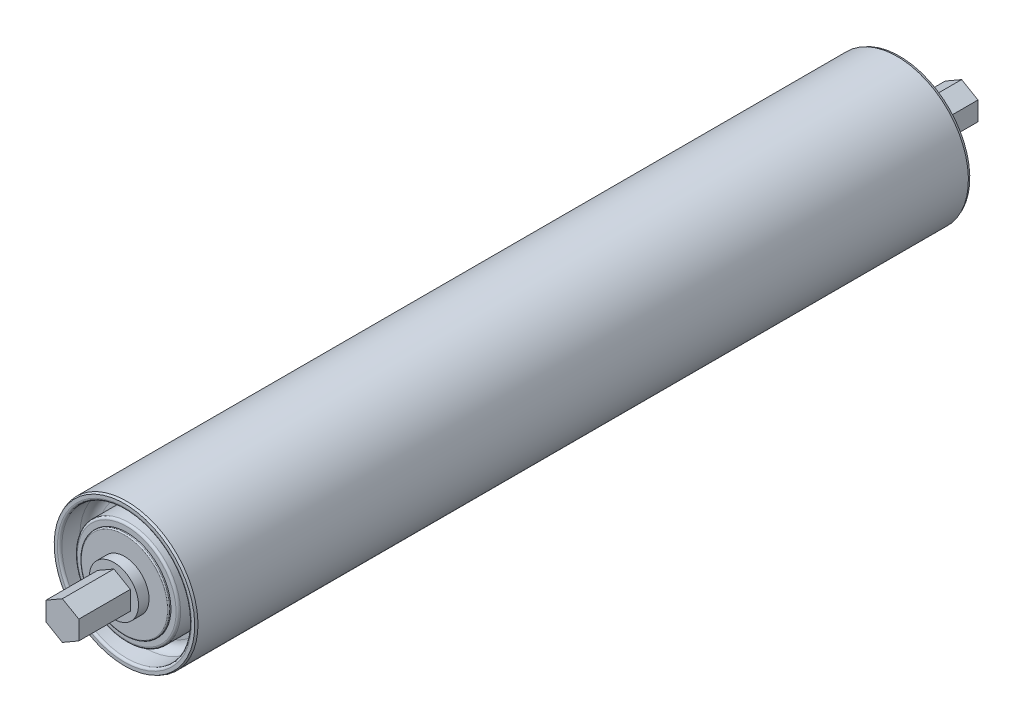
from build123d import *

# Parameters (mm, degrees)
BOSS_EXTRUDE1_REACH = 308.704


with BuildPart() as part:
    # Sketch3 → Revolve1 (revolve)
    with BuildSketch(Plane(origin=(0, 0, 0), x_dir=(0, 0, -1), z_dir=(1, 0, 0)), mode=Mode.PRIVATE) as revolve1_sk:
        Polygon((152.4, 5.55625), (134.9375, 5.55625), (134.9375, 8.334375), (131.365625, 8.334375), (131.365625, 23.8125), (130.571875, 24.13), (-130.571875, 24.13), (-131.365625, 23.8125), (-131.365625, 8.334375), (-134.9375, 8.334375), (-134.9375, 5.55625), (-152.4, 5.55625), (-152.4, 0), (152.4, 0), align=None)
    revolve(revolve1_sk.sketch.rotate(Axis((0, 0, 152.4), (0, 0, -1)), 180), axis=Axis((0, 0, 152.4), (0, 0, -1)))

    # Boss-Extrude1: up to this face of the body (flat: up to its plane)
    boss_extrude1_end = Plane(part.part.faces().sort_by_distance((0, 0, -152.4))[0])
    # Sketch4 → Boss-Extrude1 (add, up to the picked face)
    with BuildSketch(Plane.XY.offset(152.4), mode=Mode.PRIVATE) as boss_extrude1_sk1:
        Polygon((0, 6.415804866), (-5.55625, 3.207902433), (-5.55625, -3.207902433), (0, -6.415804866), (5.55625, -3.207902433), (5.55625, 3.207902433), align=None)
    boss_extrude1_tool1 = split(extrude(boss_extrude1_sk1.sketch, amount=-BOSS_EXTRUDE1_REACH, mode=Mode.PRIVATE), bisect_by=boss_extrude1_end, keep=Keep.BOTH, mode=Mode.PRIVATE)
    add(boss_extrude1_tool1.solids().sort_by(Axis((0, 0, 152.4), (0, 0, -1)))[0])

    # Sketch6 → Cut-Revolve1 (revolve, cut)
    with BuildSketch(Plane(origin=(0, 0, 0), x_dir=(0, 0, -1), z_dir=(1, 0, 0)), mode=Mode.PRIVATE) as cut_revolve1_sk:
        with BuildLine():
            Line((-124.49175, 21.971), (-130.603625, 21.971))
            ThreePointArc((-130.603625, 21.971), (-131.142440367, 22.194184633), (-131.365625, 22.733))
            Line((-131.365625, 22.733), (-131.365625, 14.620875))
            ThreePointArc((-131.365625, 14.620875), (-131.254032684, 14.890282684), (-130.984625, 15.001875))
            Line((-130.984625, 15.001875), (-130.603625, 15.001875))
            Line((-130.603625, 15.001875), (-130.603625, 16.7401875))
            ThreePointArc((-130.603625, 16.7401875), (-130.380440367, 17.279002867), (-129.841625, 17.5021875))
            Line((-129.841625, 17.5021875), (-121.44375, 17.5021875))
            Line((-121.44375, 17.5021875), (-121.44375, 18.923))
            ThreePointArc((-121.44375, 18.923), (-122.336488531, 21.078261469), (-124.49175, 21.971))
        make_face()
    cut_revolve1 = revolve(cut_revolve1_sk.sketch.rotate(Axis((0, 0, 152.4), (0, 0, -1)), 180), axis=Axis((0, 0, 152.4), (0, 0, -1)), mode=Mode.SUBTRACT)

    # Mirror2: Cut-Revolve1 across plane
    add(cut_revolve1.mirror(Plane.XY), mode=Mode.SUBTRACT)


solid = part.part
